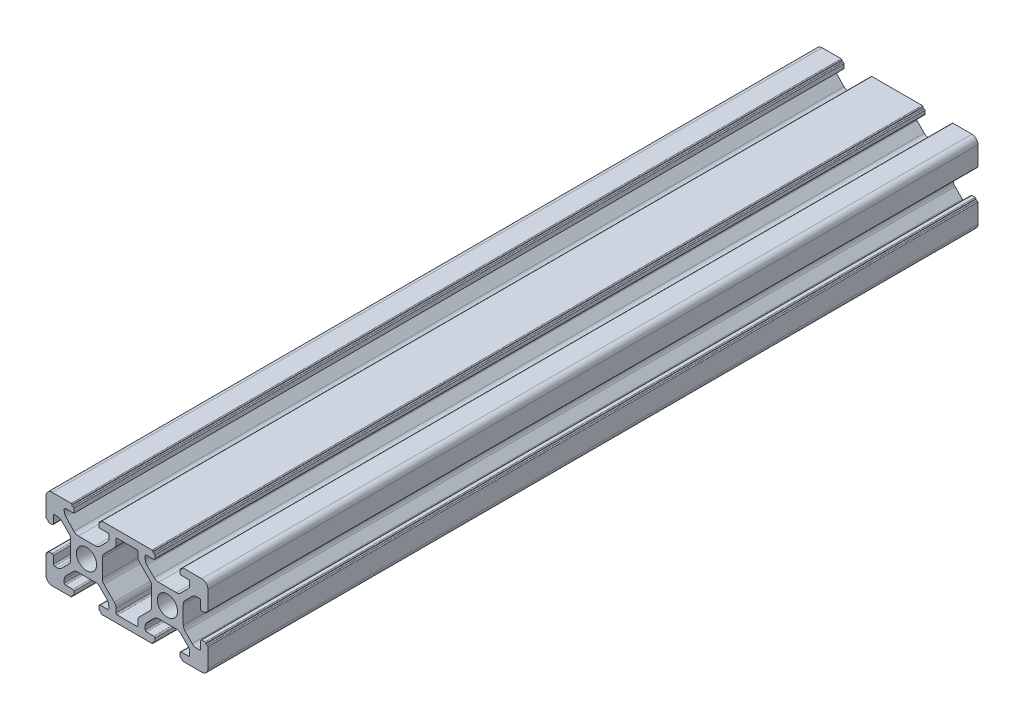
from build123d import *

# Parameters (mm, degrees)
SKETCH1_R           = 2.5
BOSS_EXTRUDE2_DEPTH = 190.2


with BuildPart() as part:
    # Sketch1 → Boss-Extrude2 (new body)
    with BuildSketch(Plane.XY):
        with BuildLine():
            Line((1.5, 0), (6.2, 0))
            ThreePointArc((6.2, 0), (6.341421356, 0.058578644), (6.4, 0.2))
            Line((6.4, 0.2), (6.4, 0.3))
            ThreePointArc((6.4, 0.3), (6.458578644, 0.441421356), (6.6, 0.5))
            Line((6.6, 0.5), (6.7, 0.5))
            ThreePointArc((6.7, 0.5), (6.841421356, 0.558578644), (6.9, 0.7))
            Line((6.9, 0.7), (6.9, 1.5))
            ThreePointArc((6.9, 1.5), (6.812132034, 1.712132034), (6.6, 1.8))
            Line((6.6, 1.8), (4.8, 1.8))
            ThreePointArc((4.8, 1.8), (4.587867966, 1.887867966), (4.5, 2.1))
            Line((4.5, 2.1), (4.5, 2.818019485))
            ThreePointArc((4.5, 2.818019485), (4.614180701, 3.392044633), (4.939339828, 3.878679656))
            Line((4.939339828, 3.878679656), (6.721320344, 5.660660172))
            ThreePointArc((6.721320344, 5.660660172), (7.207955367, 5.985819299), (7.781980515, 6.1))
            Line((7.781980515, 6.1), (12.218019485, 6.1))
            ThreePointArc((12.218019485, 6.1), (12.792044633, 5.985819299), (13.278679656, 5.660660172))
            Line((13.278679656, 5.660660172), (15.060660172, 3.878679656))
            ThreePointArc((15.060660172, 3.878679656), (15.385819299, 3.392044633), (15.5, 2.818019485))
            Line((15.5, 2.818019485), (15.5, 2.1))
            ThreePointArc((15.5, 2.1), (15.412132034, 1.887867966), (15.2, 1.8))
            Line((15.2, 1.8), (13.4, 1.8))
            ThreePointArc((13.4, 1.8), (13.187867966, 1.712132034), (13.1, 1.5))
            Line((13.1, 1.5), (13.1, 0.7))
            ThreePointArc((13.1, 0.7), (13.158578644, 0.558578644), (13.3, 0.5))
            Line((13.3, 0.5), (13.4, 0.5))
            ThreePointArc((13.4, 0.5), (13.541421356, 0.441421356), (13.6, 0.3))
            Line((13.6, 0.3), (13.6, 0.2))
            ThreePointArc((13.6, 0.2), (13.658578644, 0.058578644), (13.8, 0))
            Line((13.8, 0), (26.2, 0))
            ThreePointArc((26.2, 0), (26.341421356, 0.058578644), (26.4, 0.2))
            Line((26.4, 0.2), (26.4, 0.3))
            ThreePointArc((26.4, 0.3), (26.458578644, 0.441421356), (26.6, 0.5))
            Line((26.6, 0.5), (26.7, 0.5))
            ThreePointArc((26.7, 0.5), (26.841421356, 0.558578644), (26.9, 0.7))
            Line((26.9, 0.7), (26.9, 1.5))
            ThreePointArc((26.9, 1.5), (26.812132034, 1.712132034), (26.6, 1.8))
            Line((26.6, 1.8), (24.8, 1.8))
            ThreePointArc((24.8, 1.8), (24.587867966, 1.887867966), (24.5, 2.1))
            Line((24.5, 2.1), (24.5, 2.818019485))
            ThreePointArc((24.5, 2.818019485), (24.614180701, 3.392044633), (24.939339828, 3.878679656))
            Line((24.939339828, 3.878679656), (26.721320344, 5.660660172))
            ThreePointArc((26.721320344, 5.660660172), (27.207955367, 5.985819299), (27.781980515, 6.1))
            Line((27.781980515, 6.1), (32.218019485, 6.1))
            ThreePointArc((32.218019485, 6.1), (32.792044633, 5.985819299), (33.278679656, 5.660660172))
            Line((33.278679656, 5.660660172), (35.060660172, 3.878679656))
            ThreePointArc((35.060660172, 3.878679656), (35.385819299, 3.392044633), (35.5, 2.818019485))
            Line((35.5, 2.818019485), (35.5, 2.1))
            ThreePointArc((35.5, 2.1), (35.412132034, 1.887867966), (35.2, 1.8))
            Line((35.2, 1.8), (33.4, 1.8))
            ThreePointArc((33.4, 1.8), (33.187867966, 1.712132034), (33.1, 1.5))
            Line((33.1, 1.5), (33.1, 0.7))
            ThreePointArc((33.1, 0.7), (33.158578644, 0.558578644), (33.3, 0.5))
            Line((33.3, 0.5), (33.4, 0.5))
            ThreePointArc((33.4, 0.5), (33.541421356, 0.441421356), (33.6, 0.3))
            Line((33.6, 0.3), (33.6, 0.2))
            ThreePointArc((33.6, 0.2), (33.658578644, 0.058578644), (33.8, 0))
            Line((33.8, 0), (38.5, 0))
            ThreePointArc((38.5, 0), (39.560660172, 0.439339828), (40, 1.5))
            Line((40, 1.5), (40, 6.2))
            ThreePointArc((40, 6.2), (39.941421356, 6.341421356), (39.8, 6.4))
            Line((39.8, 6.4), (39.7, 6.4))
            ThreePointArc((39.7, 6.4), (39.558578644, 6.458578644), (39.5, 6.6))
            Line((39.5, 6.6), (39.5, 6.7))
            ThreePointArc((39.5, 6.7), (39.441421356, 6.841421356), (39.3, 6.9))
            Line((39.3, 6.9), (38.5, 6.9))
            ThreePointArc((38.5, 6.9), (38.287867966, 6.812132034), (38.2, 6.6))
            Line((38.2, 6.6), (38.2, 4.8))
            ThreePointArc((38.2, 4.8), (38.112132034, 4.587867966), (37.9, 4.5))
            Line((37.9, 4.5), (37.181980515, 4.5))
            ThreePointArc((37.181980515, 4.5), (36.607955367, 4.614180701), (36.121320344, 4.939339828))
            Line((36.121320344, 4.939339828), (34.339339828, 6.721320344))
            ThreePointArc((34.339339828, 6.721320344), (34.014180701, 7.207955367), (33.9, 7.781980515))
            Line((33.9, 7.781980515), (33.9, 12.218019485))
            ThreePointArc((33.9, 12.218019485), (34.014180701, 12.792044633), (34.339339828, 13.278679656))
            Line((34.339339828, 13.278679656), (36.121320344, 15.060660172))
            ThreePointArc((36.121320344, 15.060660172), (36.607955367, 15.385819299), (37.181980515, 15.5))
            Line((37.181980515, 15.5), (37.9, 15.5))
            ThreePointArc((37.9, 15.5), (38.112132034, 15.412132034), (38.2, 15.2))
            Line((38.2, 15.2), (38.2, 13.4))
            ThreePointArc((38.2, 13.4), (38.287867966, 13.187867966), (38.5, 13.1))
            Line((38.5, 13.1), (39.3, 13.1))
            ThreePointArc((39.3, 13.1), (39.441421356, 13.158578644), (39.5, 13.3))
            Line((39.5, 13.3), (39.5, 13.4))
            ThreePointArc((39.5, 13.4), (39.558578644, 13.541421356), (39.7, 13.6))
            Line((39.7, 13.6), (39.8, 13.6))
            ThreePointArc((39.8, 13.6), (39.941421356, 13.658578644), (40, 13.8))
            Line((40, 13.8), (40, 18.5))
            ThreePointArc((40, 18.5), (39.560660172, 19.560660172), (38.5, 20))
            Line((38.5, 20), (33.8, 20))
            ThreePointArc((33.8, 20), (33.658578644, 19.941421356), (33.6, 19.8))
            Line((33.6, 19.8), (33.6, 19.7))
            ThreePointArc((33.6, 19.7), (33.541421356, 19.558578644), (33.4, 19.5))
            Line((33.4, 19.5), (33.3, 19.5))
            ThreePointArc((33.3, 19.5), (33.158578644, 19.441421356), (33.1, 19.3))
            Line((33.1, 19.3), (33.1, 18.5))
            ThreePointArc((33.1, 18.5), (33.187867966, 18.287867966), (33.4, 18.2))
            Line((33.4, 18.2), (35.2, 18.2))
            ThreePointArc((35.2, 18.2), (35.412132034, 18.112132034), (35.5, 17.9))
            Line((35.5, 17.9), (35.5, 17.181980515))
            ThreePointArc((35.5, 17.181980515), (35.385819299, 16.607955367), (35.060660172, 16.121320344))
            Line((35.060660172, 16.121320344), (33.278679656, 14.339339828))
            ThreePointArc((33.278679656, 14.339339828), (32.792044633, 14.014180701), (32.218019485, 13.9))
            Line((32.218019485, 13.9), (27.781980515, 13.9))
            ThreePointArc((27.781980515, 13.9), (27.207955367, 14.014180701), (26.721320344, 14.339339828))
            Line((26.721320344, 14.339339828), (24.939339828, 16.121320344))
            ThreePointArc((24.939339828, 16.121320344), (24.614180701, 16.607955367), (24.5, 17.181980515))
            Line((24.5, 17.181980515), (24.5, 17.9))
            ThreePointArc((24.5, 17.9), (24.587867966, 18.112132034), (24.8, 18.2))
            Line((24.8, 18.2), (26.6, 18.2))
            ThreePointArc((26.6, 18.2), (26.812132034, 18.287867966), (26.9, 18.5))
            Line((26.9, 18.5), (26.9, 19.3))
            ThreePointArc((26.9, 19.3), (26.841421356, 19.441421356), (26.7, 19.5))
            Line((26.7, 19.5), (26.6, 19.5))
            ThreePointArc((26.6, 19.5), (26.458578644, 19.558578644), (26.4, 19.7))
            Line((26.4, 19.7), (26.4, 19.8))
            ThreePointArc((26.4, 19.8), (26.341421356, 19.941421356), (26.2, 20))
            Line((26.2, 20), (13.8, 20))
            ThreePointArc((13.8, 20), (13.658578644, 19.941421356), (13.6, 19.8))
            Line((13.6, 19.8), (13.6, 19.7))
            ThreePointArc((13.6, 19.7), (13.541421356, 19.558578644), (13.4, 19.5))
            Line((13.4, 19.5), (13.3, 19.5))
            ThreePointArc((13.3, 19.5), (13.158578644, 19.441421356), (13.1, 19.3))
            Line((13.1, 19.3), (13.1, 18.2))
            Line((13.1, 18.2), (15.3, 18.2))
            ThreePointArc((15.3, 18.2), (15.512132034, 18.112132034), (15.6, 17.9))
            Line((15.6, 17.9), (15.6, 17.281980515))
            ThreePointArc((15.6, 17.281980515), (15.485819299, 16.707955367), (15.160660172, 16.221320344))
            Line((15.160660172, 16.221320344), (13.278679656, 14.339339828))
            ThreePointArc((13.278679656, 14.339339828), (12.792044633, 14.014180701), (12.218019485, 13.9))
            Line((12.218019485, 13.9), (7.986375635, 13.9))
            ThreePointArc((7.986375635, 13.9), (7.393381044, 14.022191082), (6.896997987, 14.36885678))
            Line((6.896997987, 14.36885678), (4.910622352, 16.467414163))
            ThreePointArc((4.910622352, 16.467414163), (4.606431474, 16.943609851), (4.5, 17.498557383))
            Line((4.5, 17.498557383), (4.5, 17.9))
            ThreePointArc((4.5, 17.9), (4.587867966, 18.112132034), (4.8, 18.2))
            Line((4.8, 18.2), (6.9, 18.2))
            Line((6.9, 18.2), (6.9, 19.3))
            ThreePointArc((6.9, 19.3), (6.841421356, 19.441421356), (6.7, 19.5))
            Line((6.7, 19.5), (6.6, 19.5))
            ThreePointArc((6.6, 19.5), (6.458578644, 19.558578644), (6.4, 19.7))
            Line((6.4, 19.7), (6.4, 19.8))
            ThreePointArc((6.4, 19.8), (6.341421356, 19.941421356), (6.2, 20))
            Line((6.2, 20), (1.5, 20))
            ThreePointArc((1.5, 20), (0.439339828, 19.560660172), (0, 18.5))
            Line((0, 18.5), (0, 13.8))
            ThreePointArc((0, 13.8), (0.058578644, 13.658578644), (0.2, 13.6))
            Line((0.2, 13.6), (0.3, 13.6))
            ThreePointArc((0.3, 13.6), (0.441421356, 13.541421356), (0.5, 13.4))
            Line((0.5, 13.4), (0.5, 13.3))
            ThreePointArc((0.5, 13.3), (0.558578644, 13.158578644), (0.7, 13.1))
            Line((0.7, 13.1), (1.5, 13.1))
            ThreePointArc((1.5, 13.1), (1.712132034, 13.187867966), (1.8, 13.4))
            Line((1.8, 13.4), (1.8, 15.2))
            ThreePointArc((1.8, 15.2), (1.887867966, 15.412132034), (2.1, 15.5))
            Line((2.1, 15.5), (2.818019485, 15.5))
            ThreePointArc((2.818019485, 15.5), (3.392044633, 15.385819299), (3.878679656, 15.060660172))
            Line((3.878679656, 15.060660172), (5.660660172, 13.278679656))
            ThreePointArc((5.660660172, 13.278679656), (5.985819299, 12.792044633), (6.1, 12.218019485))
            Line((6.1, 12.218019485), (6.1, 7.781980515))
            ThreePointArc((6.1, 7.781980515), (5.985819299, 7.207955367), (5.660660172, 6.721320344))
            Line((5.660660172, 6.721320344), (3.878679656, 4.939339828))
            ThreePointArc((3.878679656, 4.939339828), (3.392044633, 4.614180701), (2.818019485, 4.5))
            Line((2.818019485, 4.5), (2.1, 4.5))
            ThreePointArc((2.1, 4.5), (1.887867966, 4.587867966), (1.8, 4.8))
            Line((1.8, 4.8), (1.8, 6.6))
            ThreePointArc((1.8, 6.6), (1.712132034, 6.812132034), (1.5, 6.9))
            Line((1.5, 6.9), (0.7, 6.9))
            ThreePointArc((0.7, 6.9), (0.558578644, 6.841421356), (0.5, 6.7))
            Line((0.5, 6.7), (0.5, 6.6))
            ThreePointArc((0.5, 6.6), (0.441421356, 6.458578644), (0.3, 6.4))
            Line((0.3, 6.4), (0.2, 6.4))
            ThreePointArc((0.2, 6.4), (0.058578644, 6.341421356), (0, 6.2))
            Line((0, 6.2), (0, 1.5))
            ThreePointArc((0, 1.5), (0.439339828, 0.439339828), (1.5, 0))
        make_face()
        with Locations(Location((10, 10, 0), (0, 0, 180))):
            Circle(SKETCH1_R, mode=Mode.SUBTRACT)
        with Locations(Location((30, 10, 0), (0, 0, 180))):
            Circle(SKETCH1_R, mode=Mode.SUBTRACT)
        with BuildLine():
            Line((17.6, 1.8), (22.4, 1.8))
            ThreePointArc((22.4, 1.8), (22.612132034, 1.887867966), (22.7, 2.1))
            Line((22.7, 2.1), (22.7, 3.139339828))
            ThreePointArc((22.7, 3.139339828), (22.814180701, 3.713364977), (23.139339828, 4.2))
            Line((23.139339828, 4.2), (25.660660172, 6.721320344))
            ThreePointArc((25.660660172, 6.721320344), (25.985819299, 7.207955367), (26.1, 7.781980515))
            Line((26.1, 7.781980515), (26.1, 12.218019485))
            ThreePointArc((26.1, 12.218019485), (25.985819299, 12.792044633), (25.660660172, 13.278679656))
            Line((25.660660172, 13.278679656), (23.139339828, 15.8))
            ThreePointArc((23.139339828, 15.8), (22.814180701, 16.286635023), (22.7, 16.860660172))
            Line((22.7, 16.860660172), (22.7, 17.9))
            ThreePointArc((22.7, 17.9), (22.612132034, 18.112132034), (22.4, 18.2))
            Line((22.4, 18.2), (17.6, 18.2))
            ThreePointArc((17.6, 18.2), (17.387867966, 18.112132034), (17.3, 17.9))
            Line((17.3, 17.9), (17.3, 16.860660172))
            ThreePointArc((17.3, 16.860660172), (17.185819299, 16.286635023), (16.860660172, 15.8))
            Line((16.860660172, 15.8), (14.339339828, 13.278679656))
            ThreePointArc((14.339339828, 13.278679656), (14.014180701, 12.792044633), (13.9, 12.218019485))
            Line((13.9, 12.218019485), (13.9, 7.781980515))
            ThreePointArc((13.9, 7.781980515), (14.014180701, 7.207955367), (14.339339828, 6.721320344))
            Line((14.339339828, 6.721320344), (16.860660172, 4.2))
            ThreePointArc((16.860660172, 4.2), (17.185819299, 3.713364977), (17.3, 3.139339828))
            Line((17.3, 3.139339828), (17.3, 2.1))
            ThreePointArc((17.3, 2.1), (17.387867966, 1.887867966), (17.6, 1.8))
        make_face(mode=Mode.SUBTRACT)
    extrude(amount=BOSS_EXTRUDE2_DEPTH)


solid = part.part
